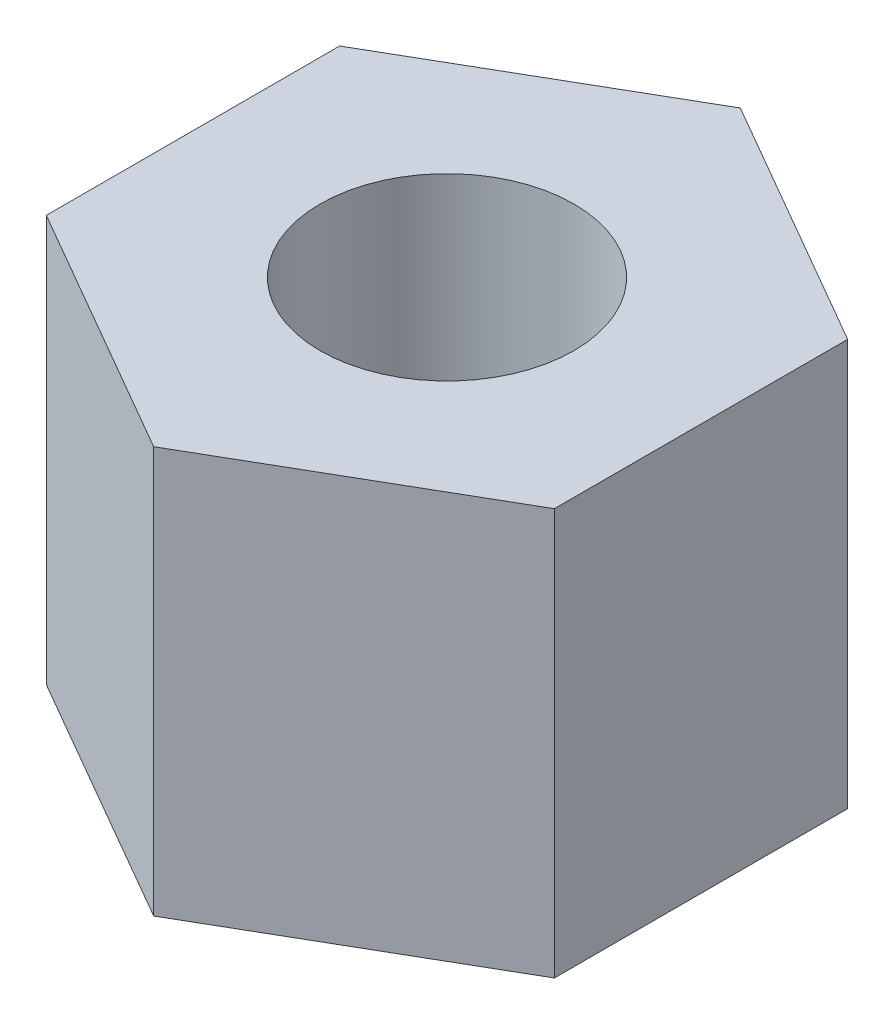
from build123d import *

# Parameters (mm, degrees)
BOSS_EXTRUDE1_DEPTH       = 4
M3X0_5_TAPPED_HOLE1_D     = 2.5
M3X0_5_TAPPED_HOLE1_DEPTH = 13.5
M3X0_5_TAPPED_HOLE1_TIP   = 0.751075774


with BuildPart() as part:
    # Sketch2 → Boss-Extrude1 (new body)
    with BuildSketch(Plane(origin=(0, 0, 0), x_dir=(1, 0, 0), z_dir=(0, 1, 0))):
        Polygon((1.25, 0.721687836), (-2.5, -1.443375673), (0, -2.886751346), (1.666666667, 0), align=None)
        Polygon((0.833333333, 1.443375673), (-2.5, 1.443375673), (-2.5, -1.443375673), (1.25, 0.721687836), align=None)
        Polygon((0.833333333, 1.443375673), (0, 2.886751346), (-2.5, 1.443375673), align=None)
        Polygon((2.5, 1.443375673), (0, 2.886751346), (0.833333333, 1.443375673), align=None)
        Polygon((1.25, 0.721687836), (2.5, 1.443375673), (0.833333333, 1.443375673), align=None)
        Polygon((1.666666667, 0), (2.5, 1.443375673), (1.25, 0.721687836), align=None)
        Polygon((2.5, -1.443375673), (2.5, 1.443375673), (1.666666667, 0), align=None)
        Polygon((0, -2.886751346), (2.5, -1.443375673), (1.666666667, 0), align=None)
    extrude(amount=BOSS_EXTRUDE1_DEPTH)

    # M3x0.5 Tapped Hole1
    with Locations(Plane(origin=(0, 0, 0), x_dir=(-1, 0, 0), z_dir=(0, -1, 0))):
        with Locations((0, 0)):
            Hole(M3X0_5_TAPPED_HOLE1_D / 2, depth=M3X0_5_TAPPED_HOLE1_DEPTH)
            with Locations((0, 0, -(M3X0_5_TAPPED_HOLE1_DEPTH + M3X0_5_TAPPED_HOLE1_TIP / 2))):  # 118° drill point
                Cone(0, M3X0_5_TAPPED_HOLE1_D / 2, M3X0_5_TAPPED_HOLE1_TIP, mode=Mode.SUBTRACT)


solid = part.part
